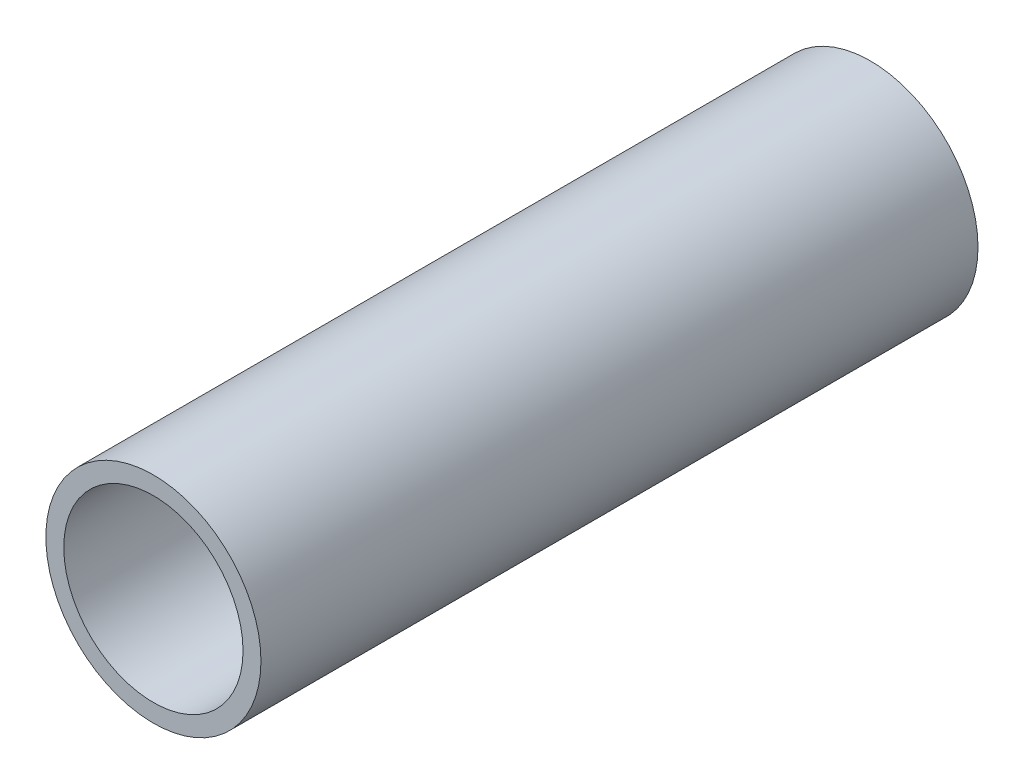
from build123d import *

# Parameters (mm, degrees)
PROFILE1_R   = 6
PROFILE1_R_2 = 5


with BuildPart() as part:
    # sweep_thin_one_dir_t1: sweep along a path in Path1
    with BuildLine(Plane(origin=(0, 0, 0), x_dir=(0, 0, -1), z_dir=(1, 0, 0))) as sweep_thin_one_dir_t1_path:
        Line((0, 0), (-40, 0))
    # Profile1 → sweep_thin_one_dir_t1 (sweep)
    with BuildSketch(Plane.XY):
        Circle(PROFILE1_R)
        Circle(PROFILE1_R_2, mode=Mode.SUBTRACT)
    sweep(path=sweep_thin_one_dir_t1_path.line)


solid = part.part
